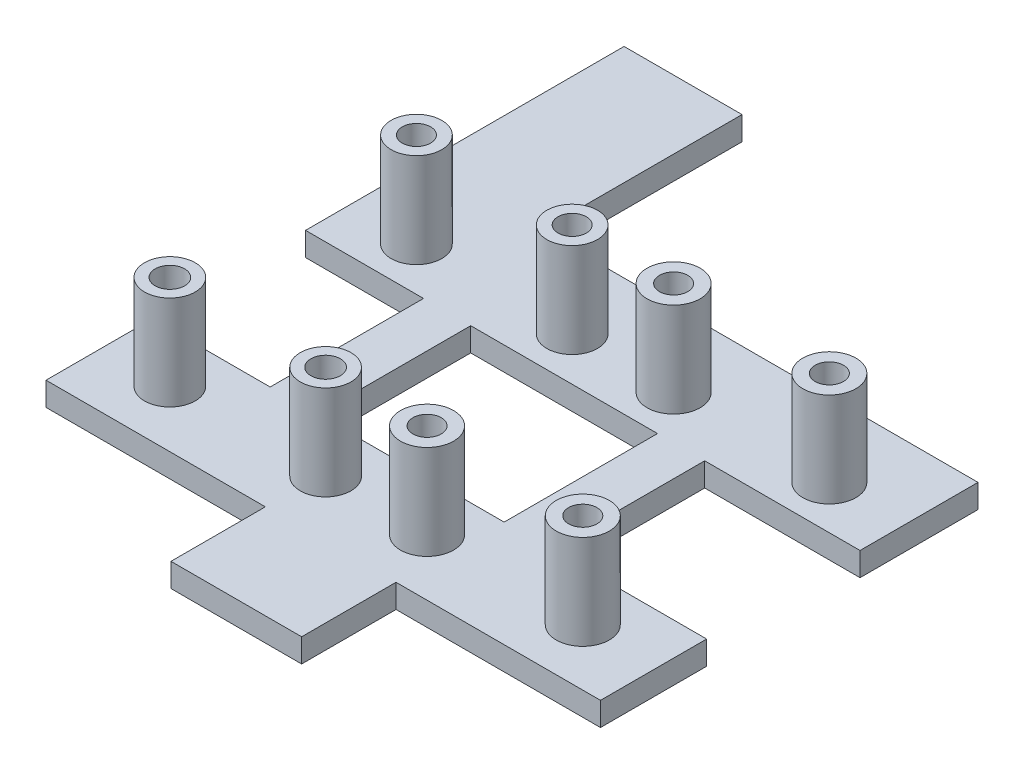
from build123d import *

# Parameters (mm, degrees)
SKETCH1_W               = 60
SKETCH1_H               = 72
BOTTOM_DEPTH            = 2
SKETCH2_R               = 2.25
PIN_LOCS_DEPTH          = 4
SKETCH5_R               = 1.25
PIN_HOLES_DEPTH         = 4
SKETCH3_R               = 2.25
SKETCH3_R_2             = 2.15
SENSOR_PINS_DEPTH       = 8
SKETCH6_R               = 1.25
SKETCH6_R_2             = 1.2
PIN_HOLES_SENSORS_DEPTH = 4
SKETCH4_W               = 8
SKETCH4_H               = 10
POWER_CABLE_DEPTH       = 2
SKETCH7_W               = 16.5
SKETCH7_H               = 25
SKETCH7_W_2             = 17
SKETCH7_H_2             = 13
SKETCH7_W_3             = 15.833991833
SKETCH7_W_4             = 13.166008167
SKETCH7_W_5             = 15.5
CUT_EXTRUDE1_DEPTH      = 2
SKETCH8_W               = 64.981954188
SKETCH8_H               = 18.550894708
CUT_EXTRUDE2_DEPTH      = 30
SKETCH9_W               = 66.656683173
SKETCH9_H               = 21.371664799
CUT_EXTRUDE3_DEPTH      = 10
SKETCH10_W              = 36.941564119
SKETCH10_H              = 17.072061012
CUT_EXTRUDE4_DEPTH      = 10
SKETCH12_W              = 38.10862574
SKETCH12_H              = 18.099687976
CUT_EXTRUDE5_DEPTH      = 3
SKETCH13_W              = 10
SKETCH13_H              = 2
BOSS_EXTRUDE1_DEPTH     = 17
SKETCH14_W              = 11.076631965
SKETCH14_H              = 2
BOSS_EXTRUDE2_DEPTH     = 8


with BuildPart() as part:
    # Sketch1 → Bottom (new body)
    with BuildSketch(Plane(origin=(0, 0, 0), x_dir=(1, 0, 0), z_dir=(0, 1, 0))):
        Rectangle(SKETCH1_W, SKETCH1_H)
    extrude(amount=BOTTOM_DEPTH)

    # Sketch2 → Pin Locs (add)
    with BuildSketch(Plane(origin=(0, 2, 0), x_dir=(1, 0, 0), z_dir=(0, 1, 0))):
        with Locations(Location((25.7, -13.1, 0), (0, 0, 90))):
            Circle(SKETCH2_R)
        with Locations(Location((-20.7, -13.1, 0), (0, 0, 270))):
            Circle(SKETCH2_R)
        with Locations(Location((25.7, -31.5, 0), (0, 0, 270))):
            Circle(SKETCH2_R)
        with Locations(Location((-20.7, -31.5, 0), (0, 0, 90))):
            Circle(SKETCH2_R)
    extrude(amount=PIN_LOCS_DEPTH)

    # Sketch5 → Pin Holes (cut)
    with BuildSketch(Plane(origin=(0, 6, 0), x_dir=(1, 0, 0), z_dir=(0, 1, 0))):
        with Locations(Location((-20.7, -31.5, 0), (0, 0, 270))):
            Circle(SKETCH5_R)
        with Locations(Location((-20.7, -13.1, 0), (0, 0, 270))):
            Circle(SKETCH5_R)
        with Locations(Location((25.7, -13.1, 0), (0, 0, 270))):
            Circle(SKETCH5_R)
        with Locations(Location((25.7, -31.5, 0), (0, 0, 270))):
            Circle(SKETCH5_R)
    extrude(amount=-PIN_HOLES_DEPTH, mode=Mode.SUBTRACT)

    # Sketch3 → Sensor Pins (add)
    with BuildSketch(Plane(origin=(0, 2, 0), x_dir=(1, 0, 0), z_dir=(0, 1, 0))):
        with Locations(Location((20.7, 19.7, 0), (0, 0, 270))):
            Circle(SKETCH3_R)
        with Locations(Location((20.7, -1.2, 0), (0, 0, 90))):
            Circle(SKETCH3_R)
        with Locations(Location((7.5, -1.2, 0), (0, 0, 270))):
            Circle(SKETCH3_R)
        with Locations(Location((7.5, 19.7, 0), (0, 0, 90))):
            Circle(SKETCH3_R)
        with Locations(Location((-1.1, 19.7, 0), (0, 0, 270))):
            Circle(SKETCH3_R_2)
        with Locations(Location((-1.1, -1.2, 0), (0, 0, 90))):
            Circle(SKETCH3_R_2)
        with Locations(Location((-14.3, -1.2, 0), (0, 0, 270))):
            Circle(SKETCH3_R_2)
        with Locations(Location((-14.3, 19.7, 0), (0, 0, 90))):
            Circle(SKETCH3_R_2)
    extrude(amount=SENSOR_PINS_DEPTH)

    # Sketch6 → Pin Holes Sensors (cut)
    with BuildSketch(Plane(origin=(0, 10, 0), x_dir=(1, 0, 0), z_dir=(0, 1, 0))):
        with Locations(Location((-14.3, -1.2, 0), (0, 0, 270))):
            Circle(SKETCH6_R)
        with Locations(Location((-1.1, -1.2, 0), (0, 0, 270))):
            Circle(SKETCH6_R)
        with Locations(Location((-1.1, 19.7, 0), (0, 0, 270))):
            Circle(SKETCH6_R_2)
        with Locations(Location((-14.3, 19.7, 0), (0, 0, 270))):
            Circle(SKETCH6_R_2)
        with Locations(Location((20.7, -1.2, 0), (0, 0, 270))):
            Circle(SKETCH6_R_2)
        with Locations(Location((20.7, 19.7, 0), (0, 0, 270))):
            Circle(SKETCH6_R_2)
        with Locations(Location((7.5, 19.7, 0), (0, 0, 270))):
            Circle(SKETCH6_R_2)
        with Locations(Location((7.5, -1.2, 0), (0, 0, 270))):
            Circle(SKETCH6_R_2)
    extrude(amount=-PIN_HOLES_SENSORS_DEPTH, mode=Mode.SUBTRACT)

    # Sketch4 → Power Cable (cut)
    with BuildSketch(Plane(origin=(0, 2, 0), x_dir=(1, 0, 0), z_dir=(0, 1, 0))):
        with Locations((26, 31)):
            Rectangle(SKETCH4_W, SKETCH4_H)
    extrude(amount=-POWER_CABLE_DEPTH, mode=Mode.SUBTRACT)

    # Sketch7 → Cut-Extrude1 (cut)
    with BuildSketch(Plane(origin=(0, 2, 0), x_dir=(1, 0, 0), z_dir=(0, 1, 0))):
        with Locations((-7.75, -20.5)):
            Rectangle(SKETCH7_W, SKETCH7_H)
        with Locations((-18.5, 9.5)):
            Rectangle(SKETCH7_W_2, SKETCH7_H_2)
        with Locations((1.916995917, 9.5)):
            Rectangle(SKETCH7_W_3, SKETCH7_H_2)
        with Locations((20.416995916, 9.5)):
            Rectangle(SKETCH7_W_4, SKETCH7_H_2)
        with Locations((12.25, -20.5)):
            Rectangle(SKETCH7_W_5, SKETCH7_H)
    extrude(amount=-CUT_EXTRUDE1_DEPTH, mode=Mode.SUBTRACT)

    # Sketch8 → Cut-Extrude2 (cut)
    with BuildSketch(Plane.XY.offset(36)):
        with Locations((-0.087810816, 5.992805319)):
            Rectangle(SKETCH8_W, SKETCH8_H)
    extrude(amount=-CUT_EXTRUDE2_DEPTH, mode=Mode.SUBTRACT)

    # Sketch9 → Cut-Extrude3 (cut)
    with BuildSketch(Plane(origin=(0, 0, -36), x_dir=(-1, 0, 0), z_dir=(0, 0, -1))):
        with Locations((-0.680170236, 4.633119296)):
            Rectangle(SKETCH9_W, SKETCH9_H)
    extrude(amount=-CUT_EXTRUDE3_DEPTH, mode=Mode.SUBTRACT)

    # Sketch10 → Cut-Extrude4 (cut)
    with BuildSketch(Plane.ZY.offset(30)):
        with Locations((-9.291501149, 5.008650235)):
            Rectangle(SKETCH10_W, SKETCH10_H)
    extrude(amount=-CUT_EXTRUDE4_DEPTH, mode=Mode.SUBTRACT)

    # Sketch12 → Cut-Extrude5 (cut)
    with BuildSketch(Plane(origin=(30, 0, 0), x_dir=(0, 0, -1), z_dir=(1, 0, 0))):
        with Locations((8.949912617, 4.668826375)):
            Rectangle(SKETCH12_W, SKETCH12_H)
    extrude(amount=-CUT_EXTRUDE5_DEPTH, mode=Mode.SUBTRACT)

    # Sketch13 → Boss-Extrude1 (add)
    with BuildSketch(Plane(origin=(0, 0, -26), x_dir=(-1, 0, 0), z_dir=(0, 0, -1))):
        with Locations((15, 1)):
            Rectangle(SKETCH13_W, SKETCH13_H)
    extrude(amount=BOSS_EXTRUDE1_DEPTH)

    # Sketch14 → Boss-Extrude2 (add)
    with BuildSketch(Plane.XY.offset(6)):
        with Locations((4.13094739, 1)):
            Rectangle(SKETCH14_W, SKETCH14_H)
    extrude(amount=BOSS_EXTRUDE2_DEPTH)


solid = part.part
